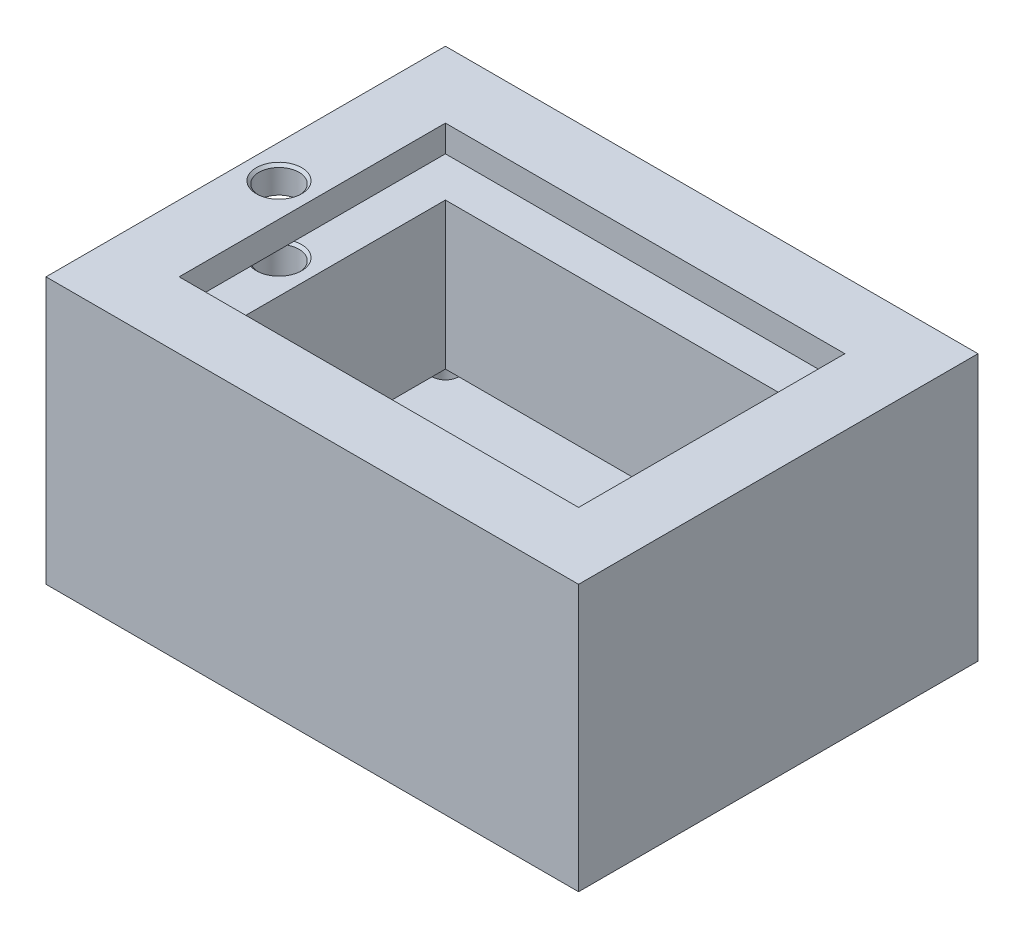
from build123d import *

# Parameters (mm, degrees)
SKETCH1_W           = 50.8
SKETCH1_H           = 38.1
BOSS_EXTRUDE1_DEPTH = 25.4
SKETCH2_W           = 38.1
SKETCH2_H           = 25.4
CUT_EXTRUDE1_DEPTH  = 20.32
SKETCH4_W           = 33.03524
SKETCH4_H           = 3.81762
CUT_EXTRUDE2_DEPTH  = 48.27524
SKETCH5_R           = 1.90881
CUT_EXTRUDE3_DEPTH  = 10.16
CHAMFER1_SIZE       = 0.254
CHAMFER2_SIZE       = 0.254
CUT_EXTRUDE4_REACH  = 39.696
SKETCH15_R          = 1.27


with BuildPart() as part:
    # Sketch1 → Boss-Extrude1 (new body)
    with BuildSketch(Plane(origin=(0, 0, 0), x_dir=(1, 0, 0), z_dir=(0, 1, 0))):
        Rectangle(SKETCH1_W, SKETCH1_H)
    extrude(amount=BOSS_EXTRUDE1_DEPTH)

    # Sketch2 → Cut-Extrude1 (cut)
    with BuildSketch(Plane(origin=(0, 25.4, 0), x_dir=(1, 0, 0), z_dir=(0, 1, 0))):
        Rectangle(SKETCH2_W, SKETCH2_H)
    extrude(amount=-CUT_EXTRUDE1_DEPTH, mode=Mode.SUBTRACT)

    # Sketch4 → Cut-Extrude2 (cut)
    with BuildSketch(Plane.ZY.offset(25.4)):
        with Locations((0, 20.95119)):
            Rectangle(SKETCH4_W, SKETCH4_H)
    extrude(amount=-CUT_EXTRUDE2_DEPTH, mode=Mode.SUBTRACT)

    # Sketch5 → Cut-Extrude3 (cut)
    with BuildSketch(Plane(origin=(0, 25.4, 0), x_dir=(1, 0, 0), z_dir=(0, 1, 0))):
        with Locations(Location((-22.225, 0, 0), (0, 0, 270))):
            Circle(SKETCH5_R)
    extrude(amount=-CUT_EXTRUDE3_DEPTH, mode=Mode.SUBTRACT)

    # Chamfer1
    chamfer1_edges = [part.edges().sort_by_distance(p)[0] for p in [
        (-22.225, 25.4, -1.90881),
    ]]
    chamfer(chamfer1_edges, length=CHAMFER1_SIZE)

    # Chamfer2
    chamfer2_edges = [part.edges().sort_by_distance(p)[0] for p in [
        (-22.225, 19.04238, -1.90881),
    ]]
    chamfer(chamfer2_edges, length=CHAMFER2_SIZE)

    # Sketch15 → Cut-Extrude4 (cut, up to next)
    with BuildSketch(Plane(origin=(0, 5.08, 0), x_dir=(1, 0, 0), z_dir=(0, 1, 0)), mode=Mode.PRIVATE) as cut_extrude4_sk1:
        with Locations(Location((-19.05, 12.7, 0), (0, 0, 270))):
            Circle(SKETCH15_R)
    cut_extrude4_tool1 = extrude(cut_extrude4_sk1.sketch, amount=-CUT_EXTRUDE4_REACH, mode=Mode.PRIVATE) & part.part
    # Sketch15 → Cut-Extrude4 (cut, up to next)
    with BuildSketch(Plane(origin=(0, 5.08, 0), x_dir=(1, 0, 0), z_dir=(0, 1, 0)), mode=Mode.PRIVATE) as cut_extrude4_sk2:
        with Locations(Location((19.05, 12.7, 0), (0, 0, 270))):
            Circle(SKETCH15_R)
    cut_extrude4_tool2 = extrude(cut_extrude4_sk2.sketch, amount=-CUT_EXTRUDE4_REACH, mode=Mode.PRIVATE) & part.part
    # Sketch15 → Cut-Extrude4 (cut, up to next)
    with BuildSketch(Plane(origin=(0, 5.08, 0), x_dir=(1, 0, 0), z_dir=(0, 1, 0)), mode=Mode.PRIVATE) as cut_extrude4_sk3:
        with Locations(Location((-19.05, -12.7, 0), (0, 0, 90))):
            Circle(SKETCH15_R)
    cut_extrude4_tool3 = extrude(cut_extrude4_sk3.sketch, amount=-CUT_EXTRUDE4_REACH, mode=Mode.PRIVATE) & part.part
    # Sketch15 → Cut-Extrude4 (cut, up to next)
    with BuildSketch(Plane(origin=(0, 5.08, 0), x_dir=(1, 0, 0), z_dir=(0, 1, 0)), mode=Mode.PRIVATE) as cut_extrude4_sk4:
        with Locations(Location((19.05, -12.7, 0), (0, 0, 90))):
            Circle(SKETCH15_R)
    cut_extrude4_tool4 = extrude(cut_extrude4_sk4.sketch, amount=-CUT_EXTRUDE4_REACH, mode=Mode.PRIVATE) & part.part
    add(cut_extrude4_tool1.solids().sort_by_distance((-19.05, 5.08, -12.7))[0], mode=Mode.SUBTRACT)
    add(cut_extrude4_tool2.solids().sort_by_distance((19.05, 5.08, -12.7))[0], mode=Mode.SUBTRACT)
    add(cut_extrude4_tool3.solids().sort_by_distance((-19.05, 5.08, 12.7))[0], mode=Mode.SUBTRACT)
    add(cut_extrude4_tool4.solids().sort_by_distance((19.05, 5.08, 12.7))[0], mode=Mode.SUBTRACT)


solid = part.part
